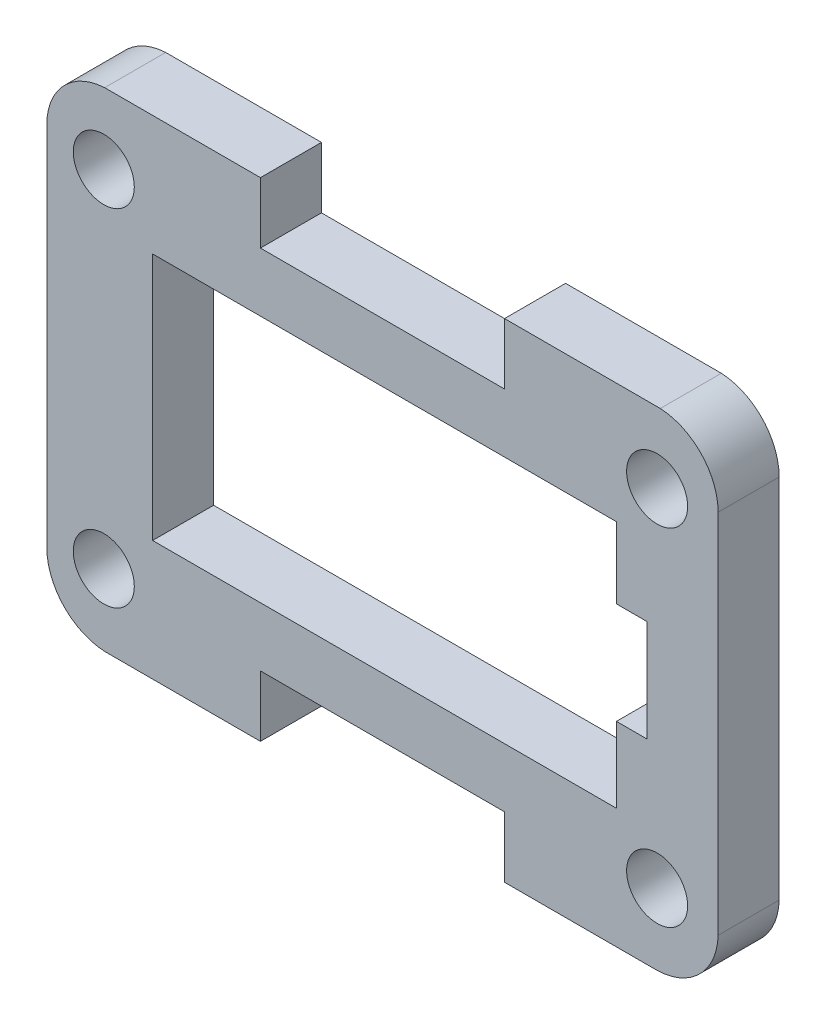
from build123d import *

# Parameters (mm, degrees)
SKETCH_1_R      = 1.500000002
SKETCH_1_R_2    = 1.5
SKETCH_1_R_3    = 1.500000008
EXTRUDE_1_DEPTH = 3


with BuildPart() as part:
    # 草圖1 → 填料-伸長1 (new body)
    with BuildSketch(Plane.XY):
        with BuildLine():
            Line((199.500112684, 87.98631657), (199.500112684, 84.98651657))
            Line((199.500112684, 84.98651657), (187.500112684, 84.98651657))
            Line((187.500112684, 84.98651657), (187.500112684, 87.98631657))
            Line((187.500112684, 87.98631657), (179.842912684, 87.98631657))
            ThreePointArc((179.842912684, 87.98631657), (177.823916024, 87.055493072), (177.000112684, 84.99051657))
            Line((177.000112684, 84.99051657), (177.000112684, 66.98231657))
            ThreePointArc((177.000112684, 66.98231657), (177.823916024, 64.917340067), (179.842912684, 63.98651657))
            Line((179.842912684, 63.98651657), (187.500112684, 63.98651657))
            Line((187.500112684, 63.98651657), (187.500112684, 66.98651657))
            Line((187.500112684, 66.98651657), (199.500112684, 66.98651657))
            Line((199.500112684, 66.98651657), (199.500112684, 63.98651657))
            Line((199.500112684, 63.98651657), (207.000112684, 63.98651657))
            ThreePointArc((207.000112684, 63.98651657), (209.097709344, 64.885982101), (210.000112684, 66.98231657))
            Line((210.000112684, 66.98231657), (210.000112685, 84.99051657))
            ThreePointArc((210.000112685, 84.99051657), (209.176309345, 87.055493072), (207.157312685, 87.98631657))
            Line((207.157312685, 87.98631657), (199.500112684, 87.98631657))
        make_face()
        with Locations((179.800012686, 67.486516568)):
            Circle(SKETCH_1_R, mode=Mode.SUBTRACT)
        with Locations((179.800062678, 84.486566583)):
            Circle(SKETCH_1_R_2, mode=Mode.SUBTRACT)
        with Locations((207.00011268, 84.486516578)):
            Circle(SKETCH_1_R_3, mode=Mode.SUBTRACT)
        with Locations((207.000062688, 67.486466573)):
            Circle(SKETCH_1_R_2, mode=Mode.SUBTRACT)
        Polygon((205.000112684, 73.588516578), (205.000112684, 69.888516578), (182.200112684, 69.888516578), (182.200112684, 82.088516578), (205.000112684, 82.088516578), (205.000112684, 78.588516578), (206.500112684, 78.588516578), (206.500112684, 73.588516578), align=None, mode=Mode.SUBTRACT)
    extrude(amount=EXTRUDE_1_DEPTH)


solid = part.part
